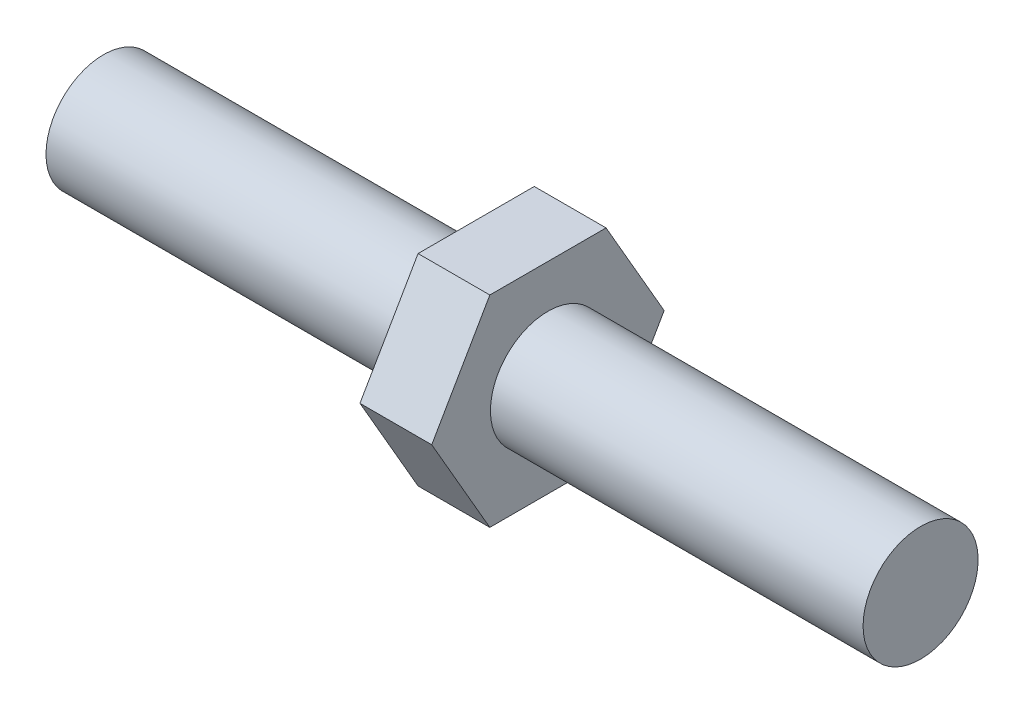
from build123d import *

# Parameters (mm, degrees)
BOSS_EXTRUDE1_REACH             = 25.885
BOSS_EXTRUDE1_DIRECTION_2_REACH = 25.885


with BuildPart() as part:
    # Sketch2 → Revolve1 (revolve)
    with BuildSketch(Plane.XY, mode=Mode.PRIVATE) as revolve1_sk:
        Polygon((-22.5552, 0), (-22.5552, 3.175), (-1.9812, 3.175), (-1.9812, 5.55625), (1.9812, 5.55625), (1.9812, 3.175), (22.5552, 3.175), (22.5552, 0), align=None)
    revolve(revolve1_sk.sketch.rotate(Axis((-22.5552, 0, 0), (1, 0, 0)), 90), axis=Axis((-22.5552, 0, 0), (1, 0, 0)))

    # Boss-Extrude1: up to this face of the body (flat: up to its plane)
    boss_extrude1_end = Plane(part.part.faces().sort_by_distance((1.9812, 0, -5.399095518))[0])
    # Sketch3 → Boss-Extrude1 (add, up to the picked face)
    with BuildSketch(Plane(origin=(0, 0, 0), x_dir=(0, 0, -1), z_dir=(1, 0, 0)), mode=Mode.PRIVATE) as boss_extrude1_sk1:
        Polygon((3.207902433, -5.55625), (6.415804866, 0), (3.207902433, 5.55625), (-3.207902433, 5.55625), (-6.415804866, 0), (-3.207902433, -5.55625), align=None)
    boss_extrude1_tool1 = split(extrude(boss_extrude1_sk1.sketch, amount=BOSS_EXTRUDE1_REACH, mode=Mode.PRIVATE), bisect_by=boss_extrude1_end, keep=Keep.BOTH, mode=Mode.PRIVATE)
    add(boss_extrude1_tool1.solids().sort_by(Axis((0, 0, 0), (1, 0, 0)))[0])

    # Boss-Extrude1 direction 2: up to this face of the body (flat: up to its plane)
    boss_extrude1_direction_2_end = Plane(part.part.faces().sort_by_distance((-1.9812, 0, -3.332154482))[0])
    # Sketch3 → Boss-Extrude1 direction 2 (add, up to the picked face)
    with BuildSketch(Plane(origin=(0, 0, 0), x_dir=(0, 0, -1), z_dir=(1, 0, 0)), mode=Mode.PRIVATE) as boss_extrude1_direction_2_sk1:
        Polygon((3.207902433, -5.55625), (6.415804866, 0), (3.207902433, 5.55625), (-3.207902433, 5.55625), (-6.415804866, 0), (-3.207902433, -5.55625), align=None)
    boss_extrude1_direction_2_tool1 = split(extrude(boss_extrude1_direction_2_sk1.sketch, amount=-BOSS_EXTRUDE1_DIRECTION_2_REACH, mode=Mode.PRIVATE), bisect_by=boss_extrude1_direction_2_end, keep=Keep.BOTH, mode=Mode.PRIVATE)
    add(boss_extrude1_direction_2_tool1.solids().sort_by(Axis((0, 0, 0), (-1, 0, 0)))[0])


solid = part.part
